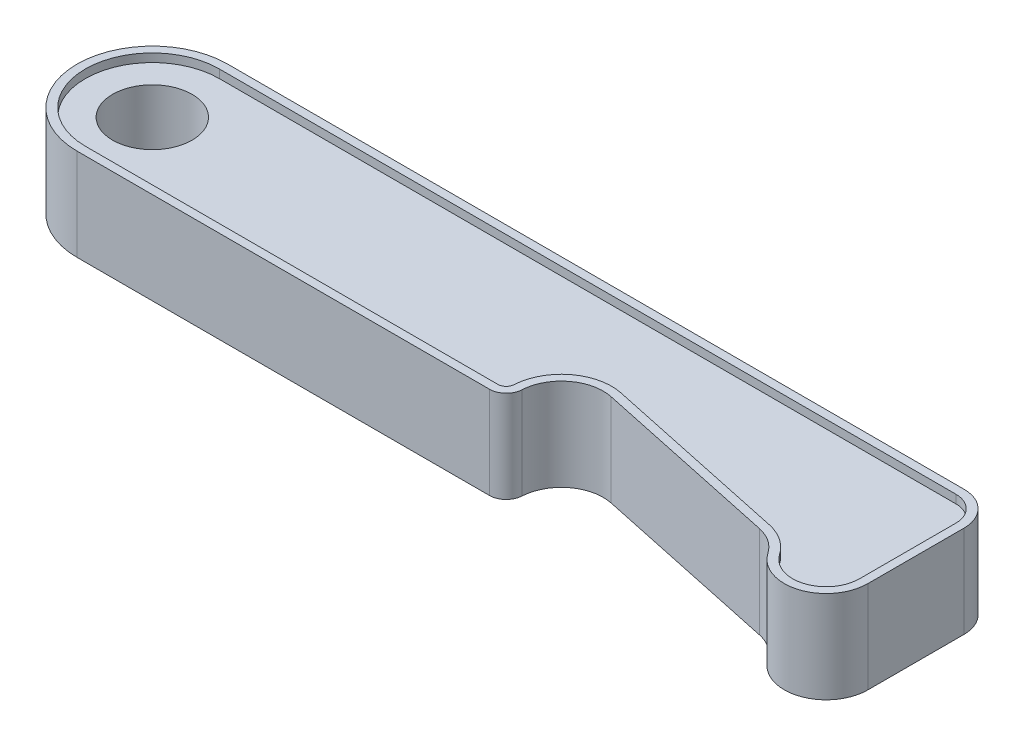
from build123d import *

# Parameters (mm, degrees)
SKETCH1_R           = 4.75
BOSS_EXTRUDE1_DEPTH = 11
CUT_EXTRUDE1_DEPTH  = 1
CUT_EXTRUDE2_START  = -1
CUT_EXTRUDE2_DEPTH  = 1


with BuildPart() as part:
    # Sketch1 → Boss-Extrude1 (new body)
    with BuildSketch(Plane(origin=(0, 0, 0), x_dir=(1, 0, 0), z_dir=(0, 1, 0))):
        with BuildLine():
            Line((19.491292084, 0.988927265), (41.991292084, -3.793595372))
            ThreePointArc((41.991292084, -3.793595372), (43.725917616, -4.524537322), (45.067363393, -5.845039159))
            ThreePointArc((45.067363393, -5.845039159), (50.669911309, -7.779535303), (54.182993157, -3.005744942))
            Line((54.182993157, -3.005744942), (54.182993157, 8.494255058))
            ThreePointArc((54.182993157, 8.494255058), (53.011420282, 11.322682182), (50.182993157, 12.494255058))
            Line((50.182993157, 12.494255058), (-37.817006843, 12.494255058))
            ThreePointArc((-37.817006843, 12.494255058), (-46.817006843, 3.494255058), (-37.817006843, -5.505744942))
            Line((-37.817006843, -5.505744942), (11.462947477, -5.505744942))
            ThreePointArc((11.462947477, -5.505744942), (12.836569821, -4.959416727), (13.459743521, -3.618906598))
            ThreePointArc((13.459743521, -3.618906598), (15.416365081, 0.071416888), (19.491292084, 0.988927265))
        make_face()
        with Locations(Location((-37.817006843, 3.494255058, 0), (0, 0, 270))):
            Circle(SKETCH1_R, mode=Mode.SUBTRACT)
    extrude(amount=BOSS_EXTRUDE1_DEPTH)

    # Sketch2 → Cut-Extrude1 (cut)
    with BuildSketch(Plane(origin=(0, 11, 0), x_dir=(1, 0, 0), z_dir=(0, 1, 0))):
        with BuildLine():
            Line((50.182993157, 11.494255058), (-37.817006843, 11.494255058))
            ThreePointArc((-37.817006843, 11.494255058), (-45.817006843, 3.494255058), (-37.817006843, -4.505744942))
            Line((-37.817006843, -4.505744942), (11.462947477, -4.505744942))
            ThreePointArc((11.462947477, -4.505744942), (12.149758649, -4.232580835), (12.461345499, -3.56232577))
            ThreePointArc((12.461345499, -3.56232577), (14.809291371, 0.866062414), (19.699203775, 1.967074866))
            Line((19.699203775, 1.967074866), (42.199203775, -2.815447772))
            ThreePointArc((42.199203775, -2.815447772), (44.280754414, -3.692578112), (45.890489346, -5.277180316))
            ThreePointArc((45.890489346, -5.277180316), (50.372527679, -6.824777231), (53.182993157, -3.005744942))
            Line((53.182993157, -3.005744942), (53.182993157, 8.494255058))
            ThreePointArc((53.182993157, 8.494255058), (52.3043135, 10.615575401), (50.182993157, 11.494255058))
        make_face()
    extrude(amount=-CUT_EXTRUDE1_DEPTH, mode=Mode.SUBTRACT)

    # Sketch3 → Cut-Extrude2 (cut)
    with BuildSketch(Plane.XZ.offset(CUT_EXTRUDE2_START)):
        with BuildLine():
            Line((11.462947477, 4.505744942), (-37.817006843, 4.505744942))
            ThreePointArc((-37.817006843, 4.505744942), (-45.817006843, -3.494255058), (-37.817006843, -11.494255058))
            Line((-37.817006843, -11.494255058), (50.182993157, -11.494255058))
            ThreePointArc((50.182993157, -11.494255058), (52.3043135, -10.615575401), (53.182993157, -8.494255058))
            Line((53.182993157, -8.494255058), (53.182993157, 3.005744942))
            ThreePointArc((53.182993157, 3.005744942), (50.372527679, 6.824777231), (45.890489346, 5.277180316))
            ThreePointArc((45.890489346, 5.277180316), (44.280754414, 3.692578112), (42.199203775, 2.815447772))
            Line((42.199203775, 2.815447772), (19.699203775, -1.967074866))
            ThreePointArc((19.699203775, -1.967074866), (14.809291371, -0.866062414), (12.461345499, 3.56232577))
            ThreePointArc((12.461345499, 3.56232577), (12.149758649, 4.232580835), (11.462947477, 4.505744942))
        make_face()
    extrude(amount=CUT_EXTRUDE2_DEPTH, mode=Mode.SUBTRACT)


solid = part.part
